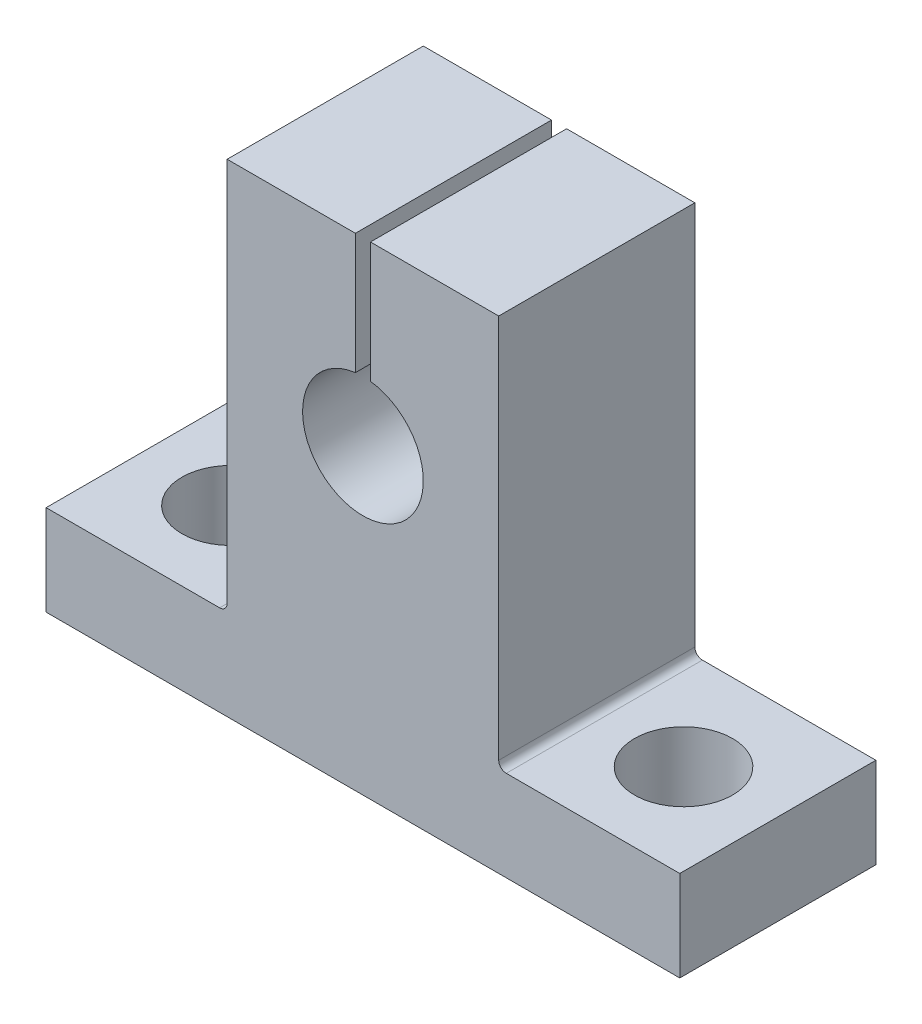
from build123d import *

# Parameters (mm, degrees)
SKETCH1_W                      = 42
SKETCH1_H                      = 32
BOSS_EXTRUDE1_DEPTH            = 13
SKETCH2_W                      = 12
SKETCH2_H                      = 26
CUT_EXTRUDE1_DEPTH             = 33.929191193
SKETCH3_W                      = 12
SKETCH3_H                      = 26
CUT_EXTRUDE2_DEPTH             = 33.929191193
CUT_EXTRUDE3_DEPTH             = 33.929191193
SKETCH5_W                      = 4
SKETCH5_H                      = 13
F_6_5_6_5_DIAMETER_HOLE1_D     = 6.5
F_6_5_6_5_DIAMETER_HOLE1_DEPTH = 32
F_6_5_6_5_DIAMETER_HOLE2_D     = 6.5
FILLET1_R                      = 0.5


with BuildPart() as part:
    # Sketch1 → Boss-Extrude1 (new body)
    with BuildSketch(Plane(origin=(0, 0, 0), x_dir=(-1, 0, 0), z_dir=(0, 0, -1))):
        with Locations((0.285714286, -5.5)):
            Rectangle(SKETCH1_W, SKETCH1_H)
    extrude(amount=-BOSS_EXTRUDE1_DEPTH)

    # Sketch2 → Cut-Extrude1 (cut, through all)
    with BuildSketch(Plane.XY.offset(13)):
        with Locations((14.714285714, -2.5)):
            Rectangle(SKETCH2_W, SKETCH2_H)
    extrude(amount=-CUT_EXTRUDE1_DEPTH, mode=Mode.SUBTRACT)

    # Sketch3 → Cut-Extrude2 (cut, through all)
    with BuildSketch(Plane.XY.offset(13)):
        with Locations((-15.285714286, -2.5)):
            Rectangle(SKETCH3_W, SKETCH3_H)
    extrude(amount=-CUT_EXTRUDE2_DEPTH, mode=Mode.SUBTRACT)

    # Sketch4 → Cut-Extrude3 (cut, through all)
    with BuildSketch(Plane.XY.offset(13)):
        with BuildLine():
            Line((0.214285714, 10.5), (-0.785714286, 10.5))
            Line((-0.785714286, 10.5), (-0.785714286, 2.5))
            ThreePointArc((-0.785714286, 2.5), (-0.285714286, 2.531373033), (0.214285714, 2.5))
            Line((0.214285714, 2.5), (0.214285714, 10.5))
        make_face()
    extrude(amount=-CUT_EXTRUDE3_DEPTH, mode=Mode.SUBTRACT)

    # Sketch5 → Cut-Revolve1 (revolve, cut)
    with BuildSketch(Plane(origin=(0, -1.468626967, 0), x_dir=(1, 0, 0), z_dir=(0, 1, 0))):
        with Locations((1.714285714, -6.5)):
            Rectangle(SKETCH5_W, SKETCH5_H)
    revolve(axis=Axis((-0.285714286, -1.468626967, 0), (0, 0, 1)), mode=Mode.SUBTRACT)

    # Ø6.5 (6.5) Diameter Hole1
    with Locations(Plane(origin=(0, -21.5, 0), x_dir=(-1, 0, 0), z_dir=(0, -1, 0))):
        with Locations((-14.714285714, -6.749358536)):
            Hole(F_6_5_6_5_DIAMETER_HOLE1_D / 2, depth=F_6_5_6_5_DIAMETER_HOLE1_DEPTH)

    # Ø6.5 (6.5) Diameter Hole2 (through all)
    with Locations(Plane(origin=(0, -15.5, 0), x_dir=(1, 0, 0), z_dir=(0, 1, 0))):
        with Locations((-15.285714286, -6.749358536)):
            Hole(F_6_5_6_5_DIAMETER_HOLE2_D / 2)

    # Fillet1
    fillet1_edges = [part.edges().sort_by_distance(p)[0] for p in [
        (8.714285714, -15.5, 6.5),
        (-9.285714286, -15.5, 6.5),
    ]]
    fillet(fillet1_edges, radius=FILLET1_R)


solid = part.part
